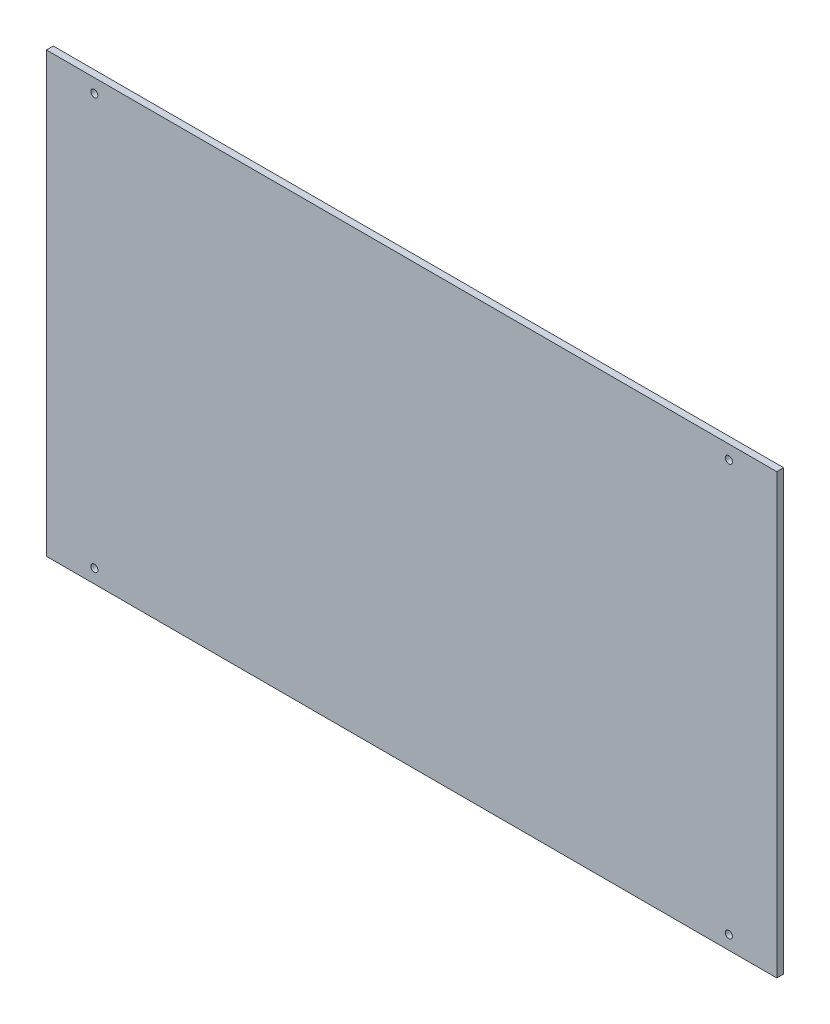
from build123d import *

# Parameters (mm, degrees)
SKETCH_1_W      = 533
SKETCH_1_H      = 320
SKETCH_1_R      = 2.6
EXTRUDE_1_DEPTH = 5


with BuildPart() as part:
    # 草图1 → 凸台-拉伸1 (new body)
    with BuildSketch(Plane.XY):
        with Locations((266.5, 160)):
            Rectangle(SKETCH_1_W, SKETCH_1_H)
        with Locations((35, 310)):
            Circle(SKETCH_1_R, mode=Mode.SUBTRACT)
        with Locations((498, 310)):
            Circle(SKETCH_1_R, mode=Mode.SUBTRACT)
        with Locations((498, 10)):
            Circle(SKETCH_1_R, mode=Mode.SUBTRACT)
        with Locations((35, 10)):
            Circle(SKETCH_1_R, mode=Mode.SUBTRACT)
    extrude(amount=EXTRUDE_1_DEPTH)


solid = part.part
